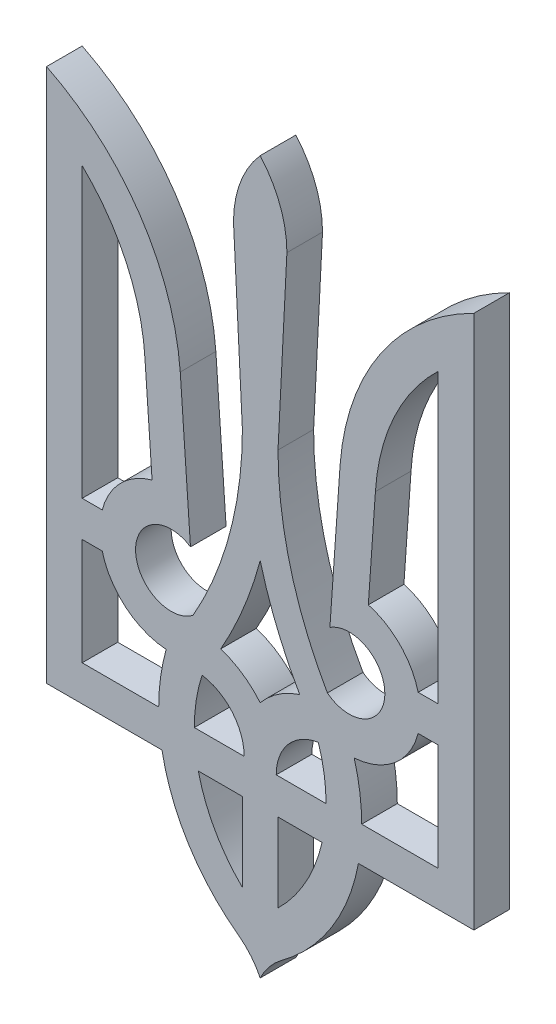
from build123d import *

# Parameters (mm, degrees)
EXTRUDE_1_DEPTH = 10


with BuildPart() as part:
    # Эскиз1 → Бобышка-Вытянуть1 (new body)
    with BuildSketch(Plane.XY):
        with BuildLine():
            Line((-60, -45), (-27.583269132, -45))
            ThreePointArc((-27.583269132, -45), (-20.06001769, -64.277376125), (-5.945767968, -79.41027067))
            ThreePointArc((-5.945767968, -79.41027067), (-2.542345747, -82.680315027), (0, -86.656865167))
            Line((0, -86.656865167), (0, -19.711115149))
            ThreePointArc((0, -19.711115149), (-5.008387109, -15.151161707), (-11.091351129, -12.172124017))
            ThreePointArc((-11.091351129, -12.172124017), (-4.677676581, 0.965070873), (0, 14.815718966))
            Line((0, 14.815718966), (0, 113.343134833))
            ThreePointArc((0, 113.343134833), (-5.562430401, 104.106601718), (-7.5, 93.5))
            Line((-7.5, 93.5), (-5, 44.25))
            ThreePointArc((-5, 44.25), (-8.525159088, 17.271181236), (-18.863936417, -7.896120801))
            ThreePointArc((-18.863936417, -7.896120801), (-34.990467135, -0.436539144), (-19.576058944, 8.401241779))
            Line((-19.576058944, 8.401241779), (-22.449472465, 49.49296956))
            ThreePointArc((-22.449472465, 49.49296956), (-33.881518529, 82.214174393), (-60, 105))
            Line((-60, 105), (-60, -45))
        make_face()
        with BuildLine():
            ThreePointArc((-26.401072965, -19.950864506), (-27.972740949, -27.40259956), (-28.5, -35))
            Line((-28.5, -35), (-50, -35))
            Line((-50, -35), (-50, -5))
            Line((-50, -5), (-44.364916731, -5))
            ThreePointArc((-44.364916731, -5), (-37.794087282, -15.372421104), (-26.401072965, -19.950864506))
        make_face(mode=Mode.SUBTRACT)
        with BuildLine():
            Line((-5, -45), (-5, -67.136427928))
            ThreePointArc((-5, -67.136427928), (-12.779082294, -56.957998409), (-17.374821937, -45))
            Line((-17.374821937, -45), (-5, -45))
        make_face(mode=Mode.SUBTRACT)
        with BuildLine():
            Line((-4.5, -35), (-18.5, -35))
            ThreePointArc((-18.5, -35), (-17.952221542, -28), (-16.322222222, -21.170419965))
            ThreePointArc((-16.322222222, -21.170419965), (-7.858362699, -25.902991945), (-4.5, -35))
        make_face(mode=Mode.SUBTRACT)
        with BuildLine():
            Line((-44.364916731, 5), (-50, 5))
            Line((-50, 5), (-50, 85.909197079))
            ThreePointArc((-50, 85.909197079), (-37.591425702, 68.515820434), (-32.355603325, 47.801370616))
            Line((-32.355603325, 47.801370616), (-30.360374841, 19.268273964))
            ThreePointArc((-30.360374841, 19.268273964), (-39.273434111, 14.009606657), (-44.364916731, 5))
        make_face(mode=Mode.SUBTRACT)
    extrude_1 = extrude(amount=EXTRUDE_1_DEPTH)

    # Зеркальное отражение1: Бобышка-Вытянуть1 across plane
    add(extrude_1.mirror(Plane(origin=(0, 0, 0), x_dir=(0, 0, 1), z_dir=(1, 0, 0))))


solid = part.part
